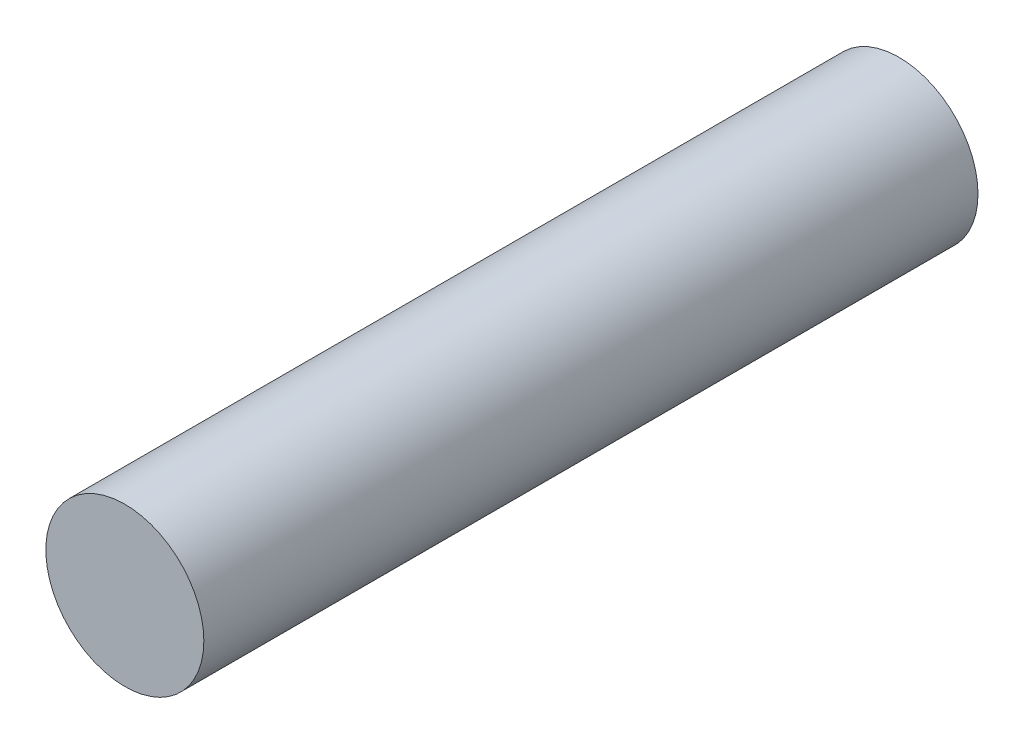
from build123d import *

# Parameters (mm, degrees)
ESQUISSE1_R        = 5
BOSS_EXTRU_1_DEPTH = 49


with BuildPart() as part:
    # Esquisse1 → Boss.-Extru.1 (new body)
    with BuildSketch(Plane.XY):
        Circle(ESQUISSE1_R)
    extrude(amount=BOSS_EXTRU_1_DEPTH)


solid = part.part
